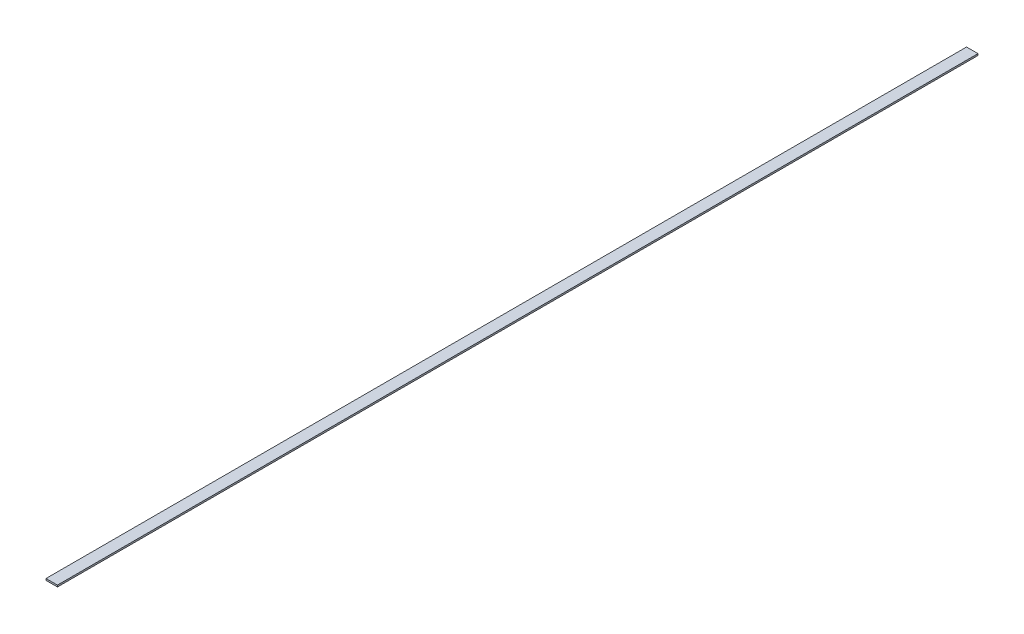
from build123d import *

# Parameters (mm, degrees)
SCHIZZO1_W                   = 8.2
SCHIZZO1_H                   = 1.2
ESTRUSIONE_ESTRUSIONE1_DEPTH = 660


with BuildPart() as part:
    # Schizzo1 → Estrusione-Estrusione1 (new body)
    with BuildSketch(Plane.XY):
        Rectangle(SCHIZZO1_W, SCHIZZO1_H)
    extrude(amount=ESTRUSIONE_ESTRUSIONE1_DEPTH)


solid = part.part
